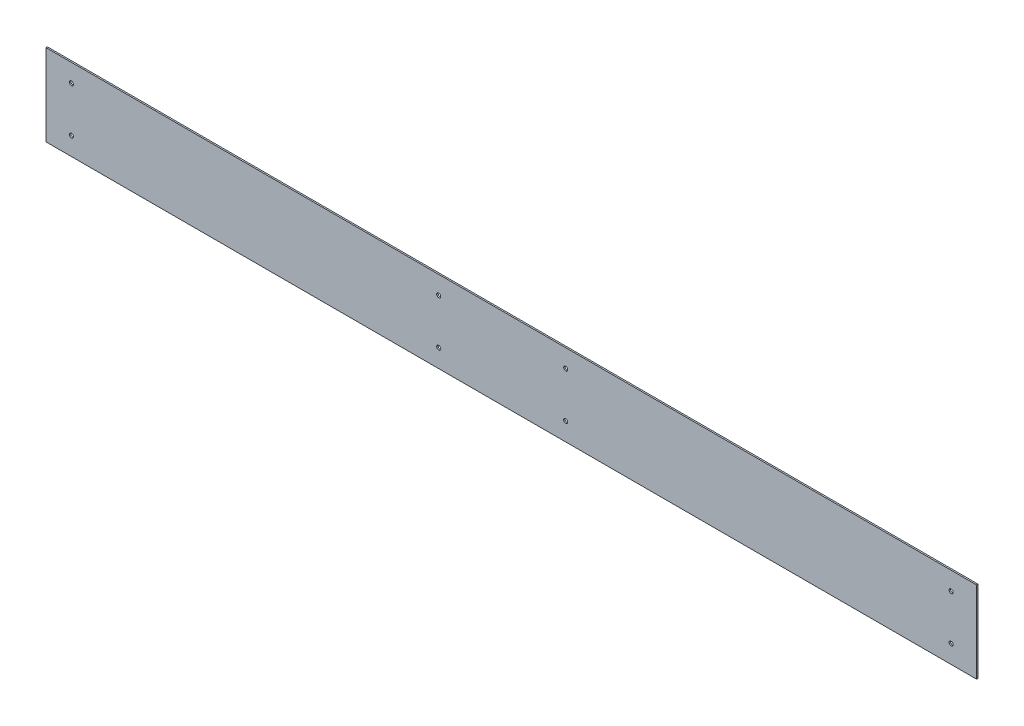
from build123d import *

# Parameters (mm, degrees)
SKETCH1_W            = 1026
SKETCH1_H            = 90
BOSS_EXTRUDE1_DEPTH  = 1.5875
M4_CLEARANCE_HOLE1_D = 4.5


with BuildPart() as part:
    # Sketch1 → Boss-Extrude1 (new body)
    with BuildSketch(Plane.XY):
        Rectangle(SKETCH1_W, SKETCH1_H)
    extrude(amount=BOSS_EXTRUDE1_DEPTH)

    # M4 Clearance Hole1 (through all)
    with Locations(Plane.XY.offset(1.5875)):
        with Locations((-485, 25), (-485, -25), (485, -25), (485, 25), (-80, 25), (-80, -25), (60, 25), (60, -25)):
            Hole(M4_CLEARANCE_HOLE1_D / 2)


solid = part.part
